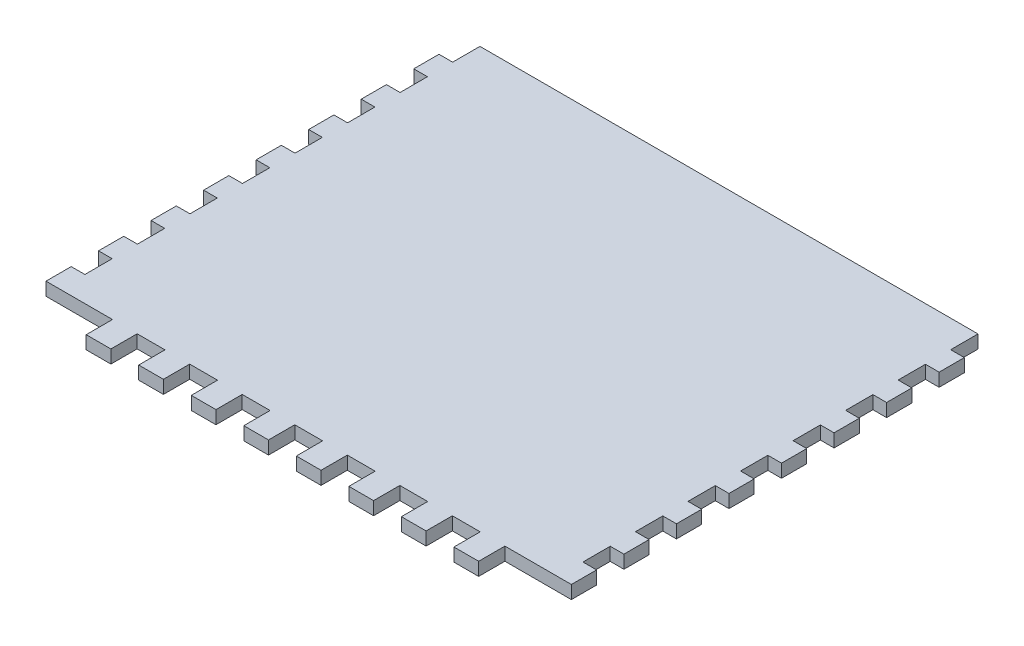
from build123d import *

# Parameters (mm, degrees)
SKETCH1_W           = 127
SKETCH1_H           = 107.95
BOSS_EXTRUDE1_DEPTH = 3.175
SKETCH2_W           = 3.302
SKETCH2_H           = 6.604
CUT_EXTRUDE1_DEPTH  = 84.400427157


with BuildPart() as part:
    # Sketch1 → Boss-Extrude1 (new body)
    with BuildSketch(Plane(origin=(0, 0, 0), x_dir=(1, 0, 0), z_dir=(0, 1, 0))):
        Rectangle(SKETCH1_W, SKETCH1_H)
    extrude(amount=BOSS_EXTRUDE1_DEPTH)

    # Sketch2 → Cut-Extrude1 (cut, through all)
    with BuildSketch(Plane.XZ):
        Polygon((-34.7345, 47.625), (-41.4655, 47.625), (-41.4655, 54.229), (-47.4345, 54.229), (-47.4345, 47.625), (-60.198, 47.625), (-63.5, 47.625), (-63.5, 54.229), (-63.5, 63.03162391), (63.5, 63.03162391), (63.5, 54.229), (63.5, 47.625), (60.198, 47.625), (47.4345, 47.625), (47.4345, 54.229), (41.4655, 54.229), (41.4655, 47.625), (34.7345, 47.625), (34.7345, 54.229), (28.7655, 54.229), (28.7655, 47.625), (22.0345, 47.625), (22.0345, 54.229), (16.0655, 54.229), (16.0655, 47.625), (9.3345, 47.625), (9.3345, 54.229), (3.3655, 54.229), (3.3655, 47.625), (-3.3655, 47.625), (-3.3655, 54.229), (-9.3345, 54.229), (-9.3345, 47.625), (-16.0655, 47.625), (-16.0655, 54.229), (-22.0345, 54.229), (-22.0345, 47.625), (-28.7655, 47.625), (-28.7655, 54.229), (-34.7345, 54.229), align=None)
        with Locations((61.849, 38.227)):
            Rectangle(SKETCH2_W, SKETCH2_H)
        with Locations((61.849, 25.527)):
            Rectangle(SKETCH2_W, SKETCH2_H)
        with Locations((61.849, 12.827)):
            Rectangle(SKETCH2_W, SKETCH2_H)
        with Locations((61.849, 0.127)):
            Rectangle(SKETCH2_W, SKETCH2_H)
        with Locations((61.849, -12.573)):
            Rectangle(SKETCH2_W, SKETCH2_H)
        with Locations((61.849, -25.273)):
            Rectangle(SKETCH2_W, SKETCH2_H)
        with Locations((61.849, -37.973)):
            Rectangle(SKETCH2_W, SKETCH2_H)
        with Locations((-61.849, -37.973)):
            Rectangle(SKETCH2_W, SKETCH2_H)
        with Locations((-61.849, -25.273)):
            Rectangle(SKETCH2_W, SKETCH2_H)
        with Locations((-61.849, -12.573)):
            Rectangle(SKETCH2_W, SKETCH2_H)
        with Locations((-61.849, 0.127)):
            Rectangle(SKETCH2_W, SKETCH2_H)
        with Locations((-61.849, 12.827)):
            Rectangle(SKETCH2_W, SKETCH2_H)
        with Locations((-61.849, 25.527)):
            Rectangle(SKETCH2_W, SKETCH2_H)
        with Locations((-61.849, 38.227)):
            Rectangle(SKETCH2_W, SKETCH2_H)
        with Locations((61.849, -50.673)):
            Rectangle(SKETCH2_W, SKETCH2_H)
        with Locations((-61.849, -50.673)):
            Rectangle(SKETCH2_W, SKETCH2_H)
    extrude(amount=-CUT_EXTRUDE1_DEPTH, mode=Mode.SUBTRACT)


solid = part.part
